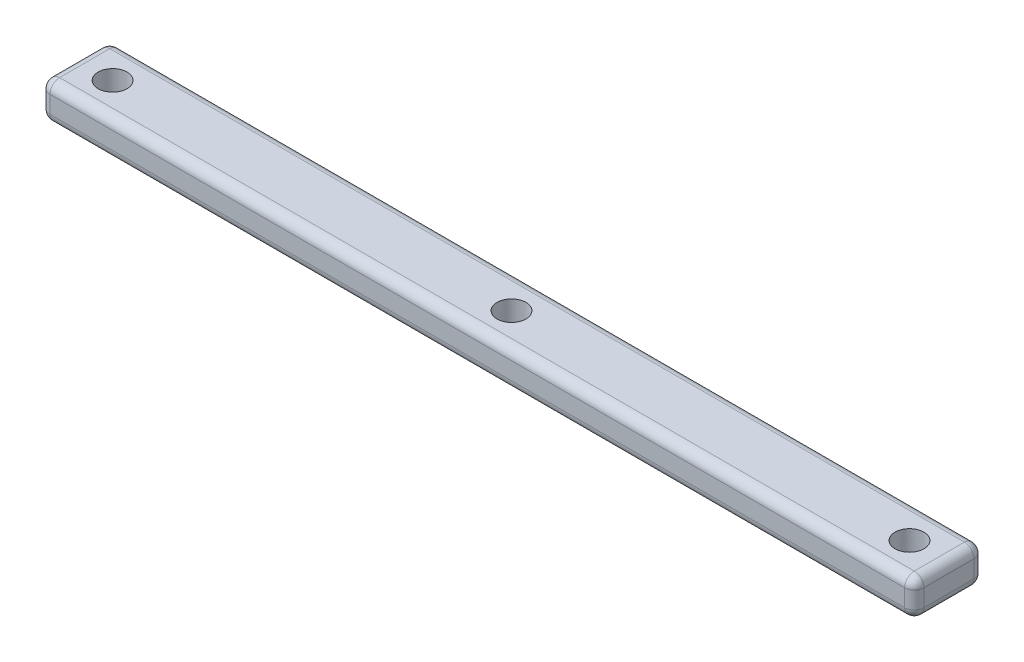
from build123d import *

# Parameters (mm, degrees)
SKETCH1_W           = 90.7
SKETCH1_H           = 7.2
SKETCH1_R           = 1.5
BOSS_EXTRUDE1_DEPTH = 3.8
FILLET1_R           = 1


with BuildPart() as part:
    # Sketch1 → Boss-Extrude1 (new body)
    with BuildSketch(Plane(origin=(0, 0, 0), x_dir=(1, 0, 0), z_dir=(0, 1, 0))):
        Rectangle(SKETCH1_W, SKETCH1_H)
        with Locations(Location((-41.35, -0.1, 0), (0, 0, 90))):
            Circle(SKETCH1_R, mode=Mode.SUBTRACT)
        with Locations(Location((0.05, -0.1, 0), (0, 0, 90))):
            Circle(SKETCH1_R, mode=Mode.SUBTRACT)
        with Locations(Location((41.35, -0.1, 0), (0, 0, 90))):
            Circle(SKETCH1_R, mode=Mode.SUBTRACT)
    extrude(amount=BOSS_EXTRUDE1_DEPTH)

    # Fillet1
    fillet1_edges = [part.edges().sort_by_distance(p)[0] for p in [
        (45.35, 3.8, 0),
        (0, 3.8, -3.6),
        (-45.35, 3.8, 0),
        (0, 0, -3.6),
        (45.35, 0, 0),
        (0, 0, 3.6),
        (-45.35, 0, 0),
        (-45.35, 1.9, -3.6),
        (45.35, 1.9, -3.6),
        (45.35, 1.9, 3.6),
        (-45.35, 1.9, 3.6),
        (0, 3.8, 3.6),
    ]]
    fillet(fillet1_edges, radius=FILLET1_R)


solid = part.part
